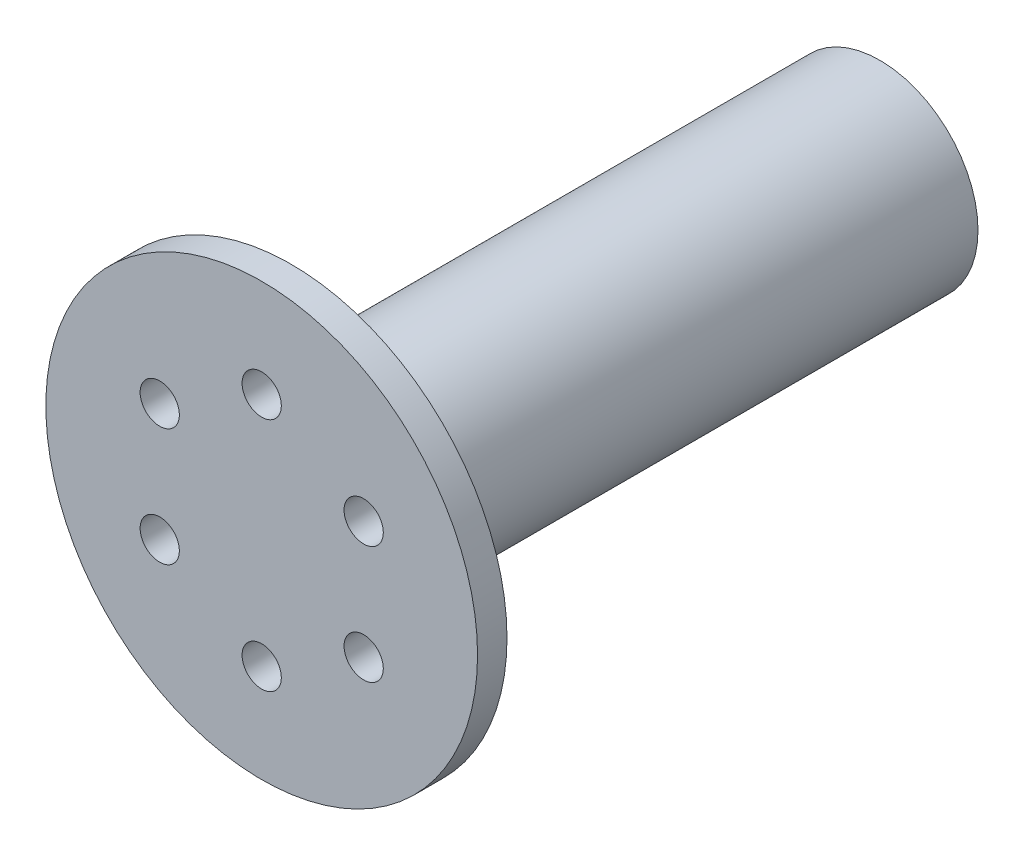
from build123d import *

# Parameters (mm, degrees)
SKETCH1_R           = 5
BOSS_EXTRUDE1_DEPTH = 30
CUT_EXTRUDE1_DEPTH  = 20
SKETCH3_R           = 11
BOSS_EXTRUDE2_DEPTH = 1.5
SKETCH4_R           = 1
CUT_EXTRUDE2_DEPTH  = 1.5


with BuildPart() as part:
    # Sketch1 → Boss-Extrude1 (new body)
    with BuildSketch(Plane.XY):
        Circle(SKETCH1_R)
    extrude(amount=BOSS_EXTRUDE1_DEPTH)

    # Sketch2 → Cut-Extrude1 (cut)
    with BuildSketch(Plane(origin=(0, 0, 0), x_dir=(-1, 0, 0), z_dir=(0, 0, -1))):
        with BuildLine():
            Line((-0.5, -1.414213562), (-0.5, -2.514037514))
            Line((-0.5, -2.514037514), (0.5, -2.514037514))
            Line((0.5, -2.514037514), (0.5, -1.414213562))
            ThreePointArc((0.5, -1.414213562), (0, 1.5), (-0.5, -1.414213562))
        make_face()
    extrude(amount=-CUT_EXTRUDE1_DEPTH, mode=Mode.SUBTRACT)

    # Sketch3 → Boss-Extrude2 (add)
    with BuildSketch(Plane.XY.offset(30)):
        Circle(SKETCH3_R)
    extrude(amount=BOSS_EXTRUDE2_DEPTH)

    # Sketch4 → Cut-Extrude2 (cut)
    with BuildSketch(Plane.XY.offset(31.5)):
        with Locations((0, 6)):
            Circle(SKETCH4_R)
        with Locations((5.196152423, 3)):
            Circle(SKETCH4_R)
        with Locations((5.196152423, -3)):
            Circle(SKETCH4_R)
        with Locations((0, -6)):
            Circle(SKETCH4_R)
        with Locations((-5.196152423, -3)):
            Circle(SKETCH4_R)
        with Locations((-5.196152423, 3)):
            Circle(SKETCH4_R)
    extrude(amount=-CUT_EXTRUDE2_DEPTH, mode=Mode.SUBTRACT)


solid = part.part
